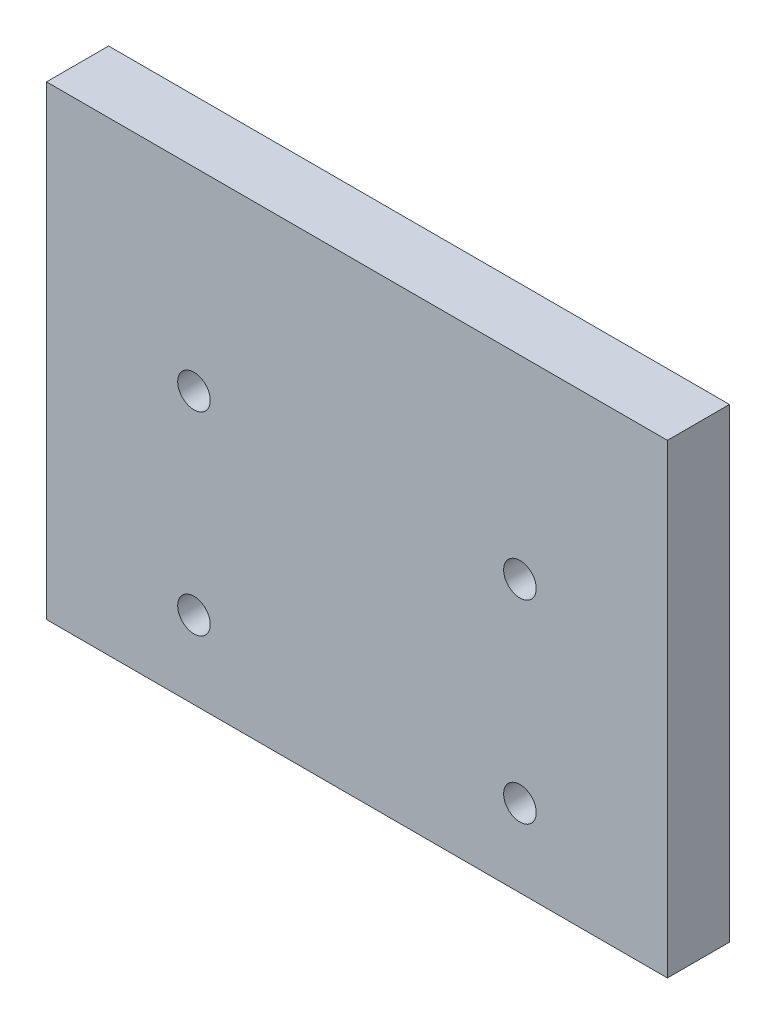
from build123d import *

# Parameters (mm, degrees)
SKETCH1_W           = 40
SKETCH1_H           = 30
BOSS_EXTRUDE1_DEPTH = 4
SKETCH2_R           = 1.05
CUT_EXTRUDE1_DEPTH  = 26.317977802


with BuildPart() as part:
    # Sketch1 → Boss-Extrude1 (new body)
    with BuildSketch(Plane.XY):
        Rectangle(SKETCH1_W, SKETCH1_H)
    extrude(amount=BOSS_EXTRUDE1_DEPTH)

    # Sketch2 → Cut-Extrude1 (cut, through all)
    with BuildSketch(Plane(origin=(0, 0, 0), x_dir=(-1, 0, 0), z_dir=(0, 0, -1))):
        with Locations((-10.5, 2.5)):
            Circle(SKETCH2_R)
        with Locations((10.5, 2.5)):
            Circle(SKETCH2_R)
        with Locations((-10.5, -10)):
            Circle(SKETCH2_R)
        with Locations((10.5, -10)):
            Circle(SKETCH2_R)
    extrude(amount=-CUT_EXTRUDE1_DEPTH, mode=Mode.SUBTRACT)


solid = part.part
